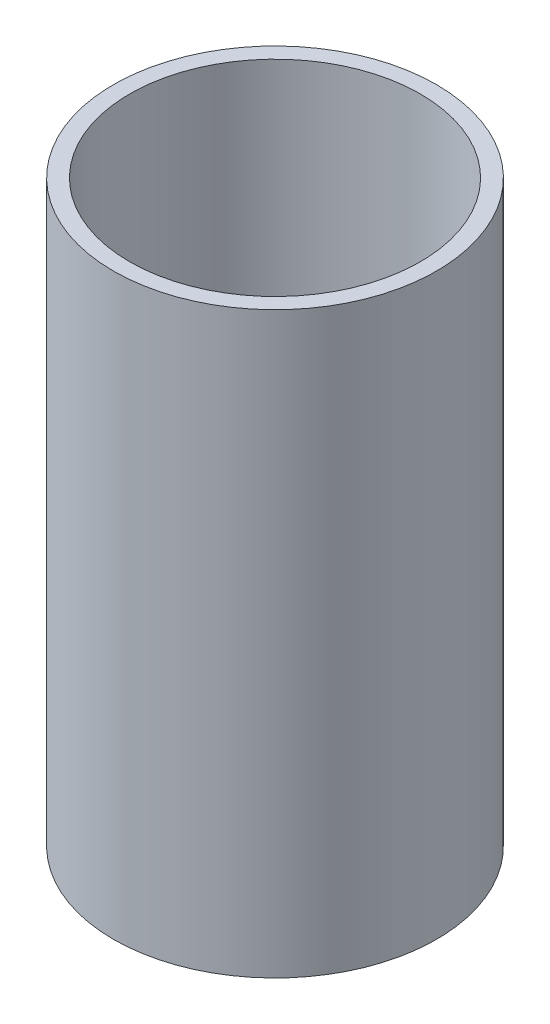
from build123d import *

# Parameters (mm, degrees)
SKETCH1_R                            = 20
BOSS_EXTRUDE1_DEPTH                  = 10
SKETCH1_R_2                          = 40
SKETCH1_R_3                          = 36
BOSS_EXTRUDE1_2_DEPTH                = 10
BOSS_EXTRUDE2_REACH                  = 89.446
BOSS_EXTRUDE2_END_RADIUS             = 36
BOSS_EXTRUDE2_START                  = 30
BOSS_EXTRUDE2_DIRECTION_2_REACH      = 89.446
BOSS_EXTRUDE2_DIRECTION_2_END_RADIUS = 20
CIRPATTERN1_COUNT                    = 12
SKETCH5_R                            = 3.167731354
BOSS_EXTRUDE3_DEPTH                  = 10
SCALE1_SCALE                         = 0.75
SKETCH6_R                            = 30
SKETCH6_R_2                          = 27
BOSS_EXTRUDE4_DEPTH                  = 100


with BuildPart() as part:
    # Sketch1 → Boss-Extrude1 (new body)
    with BuildSketch(Plane(origin=(0, 0, 0), x_dir=(1, 0, 0), z_dir=(0, 1, 0))):
        with Locations(Location((0, 0, 0), (0, 0, 270))):
            Circle(SKETCH1_R)
    extrude(amount=BOSS_EXTRUDE1_DEPTH)


with BuildPart() as body_2:
    # Sketch1 → Boss-Extrude1 2 (new body)
    with BuildSketch(Plane(origin=(0, 0, 0), x_dir=(1, 0, 0), z_dir=(0, 1, 0))):
        with Locations(Location((0, 0, 0), (0, 0, 270))):
            Circle(SKETCH1_R_2)
        with Locations(Location((0, 0, 0), (0, 0, 270))):
            Circle(SKETCH1_R_3, mode=Mode.SUBTRACT)
    extrude(amount=BOSS_EXTRUDE1_2_DEPTH)


    add(part.part)  # Boss-Extrude2 merges part
    # Boss-Extrude2: up to this cylinder (the profile starts inside it)
    boss_extrude2_end = Plane(origin=(0, 5, 0), z_dir=(0, -1, 0)) * Cylinder(BOSS_EXTRUDE2_END_RADIUS, 251.892, mode=Mode.PRIVATE)
    # Sketch4 → Boss-Extrude2 (add, up to the surface)
    with BuildSketch(Plane(origin=(0, 0, 0), x_dir=(0, 0, -1), z_dir=(1, 0, 0)).offset(BOSS_EXTRUDE2_START), mode=Mode.PRIVATE) as boss_extrude2_sk1:
        Polygon((-4.262410526, 0), (4.031443844, 10), (5.315133993, 10), (-2.978720377, 0), align=None)
    boss_extrude2_tool1 = extrude(boss_extrude2_sk1.sketch, amount=BOSS_EXTRUDE2_REACH, mode=Mode.PRIVATE) & boss_extrude2_end
    boss_extrude2 = boss_extrude2_tool1.solids().sort_by_distance((30, 5, -0.526362))[0]
    add(boss_extrude2)

    # Boss-Extrude2 direction 2: up to this cylinder (the profile starts outside it)
    boss_extrude2_direction_2_end = Plane(origin=(0, 5, 0), z_dir=(0, -1, 0)) * Cylinder(BOSS_EXTRUDE2_DIRECTION_2_END_RADIUS, 219.892, mode=Mode.PRIVATE)
    # Sketch4 → Boss-Extrude2 direction 2 (add, up to the surface)
    with BuildSketch(Plane(origin=(0, 0, 0), x_dir=(0, 0, -1), z_dir=(1, 0, 0)).offset(BOSS_EXTRUDE2_START), mode=Mode.PRIVATE) as boss_extrude2_direction_2_sk1:
        Polygon((-4.262410526, 0), (4.031443844, 10), (5.315133993, 10), (-2.978720377, 0), align=None)
    boss_extrude2_direction_2_tool1 = extrude(boss_extrude2_direction_2_sk1.sketch, amount=-BOSS_EXTRUDE2_DIRECTION_2_REACH, mode=Mode.PRIVATE) - boss_extrude2_direction_2_end
    boss_extrude2_direction_2 = boss_extrude2_direction_2_tool1.solids().sort_by_distance((30, 5, -0.526362))[0]
    add(boss_extrude2_direction_2)
    boss_extrude2 = boss_extrude2 + boss_extrude2_direction_2  # both directions under the feature's name, for the pattern or mirror that repeats it

    # CirPattern1: Boss-Extrude2 ×12 about axis
    cirpattern1_axis = Axis((0, 0, 0), (0, 1, 0))
    for i in range(1, CIRPATTERN1_COUNT):
        add(boss_extrude2.rotate(cirpattern1_axis, i * 360 / CIRPATTERN1_COUNT))

    # Sketch5 → Boss-Extrude3 (add)
    with BuildSketch(Plane(origin=(0, 10, 0), x_dir=(1, 0, 0), z_dir=(0, 1, 0))):
        with Locations(Location((0, 0, 0), (0, 0, 270))):
            Circle(SKETCH5_R)
    extrude(amount=BOSS_EXTRUDE3_DEPTH)


with BuildPart() as body_2_1:
    # Scale1: scaled about (0, 0, 0)
    add(body_2.part.scale(SCALE1_SCALE))

    # Sketch6 → Boss-Extrude4 (add)
    with BuildSketch(Plane(origin=(0, 7.5, 0), x_dir=(1, 0, 0), z_dir=(0, 1, 0))):
        with Locations(Location((0, 0, 0), (0, 0, 270))):
            Circle(SKETCH6_R)
        with Locations(Location((0, 0, 0), (0, 0, 85.253793096))):
            Circle(SKETCH6_R_2, mode=Mode.SUBTRACT)
    extrude(amount=BOSS_EXTRUDE4_DEPTH)


solid = body_2_1.part
